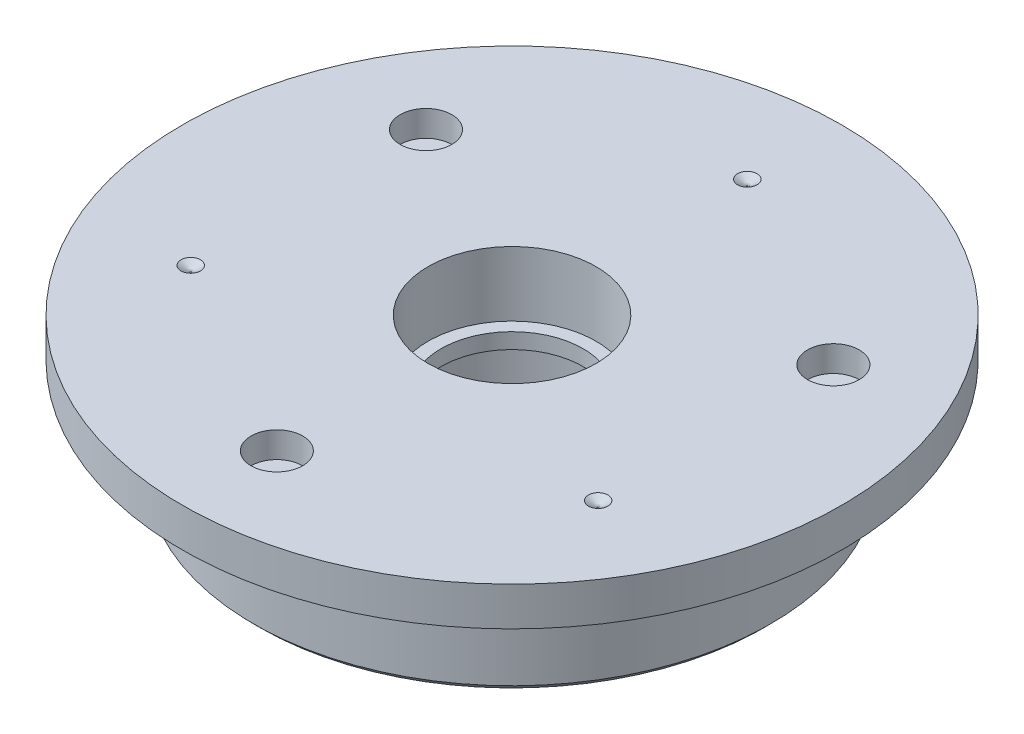
from build123d import *

# Parameters (mm, degrees)
SKETCH_1_W                  = 25.5
SKETCH_1_H                  = 3
SKETCH_2_R                  = 21.5
EXTRUDE_1_DEPTH             = 0.8
SKETCH_3_R                  = 20
EXTRUDE_2_DEPTH             = 7.4
HOLE_WIZARD_3_0_3_1_D       = 3
HOLE_WIZARD_3_0_3_1_DEPTH   = 3
HOLE_WIZARD_3_3_3_3_1_D     = 3.3
HOLE_WIZARD_3_3_3_3_1_DEPTH = 8
HOLE_WIZARD_3_3_3_3_1_TIP   = 0.991420021
HOLE_WIZARD_4_0_4_1_D       = 4
HOLE_WIZARD_4_0_4_1_DEPTH   = 2
CHAMFER_1_SIZE              = 0.375
CHAMFER_2_SIZE              = 0.5


with BuildPart() as part:
    # 草图1 → 旋转1 (revolve)
    with BuildSketch(Plane.XY, mode=Mode.PRIVATE) as revolve_1_sk:
        with Locations((12.75, -18.3)):
            Rectangle(SKETCH_1_W, SKETCH_1_H)
    revolve(revolve_1_sk.sketch.rotate(Axis((0, -16.8, 0), (0, -1, 0)), 270), axis=Axis((0, -16.8, 0), (0, -1, 0)))

    # 草图2 → 凸台-拉伸1 (add)
    with BuildSketch(Plane.XZ.offset(19.8)):
        with Locations(Location((0, 0, 0), (0, 0, 90))):
            Circle(SKETCH_2_R)
    extrude(amount=EXTRUDE_1_DEPTH)

    # 草图3 → 凸台-拉伸2 (add)
    with BuildSketch(Plane.XZ.offset(20.6)):
        with Locations(Location((0, 0, 0), (0, 0, 270))):
            Circle(SKETCH_3_R)
    extrude(amount=EXTRUDE_2_DEPTH)

    # 草图4 → 切除-旋转1 (revolve, cut)
    with BuildSketch(Plane.XY.offset(9.1), mode=Mode.PRIVATE) as cut_revolve_1_sk:
        Polygon((-15.010946194, -16.8), (-15.761662349, -16.8), (-15.761662349, -17.251075774), align=None)
    revolve(cut_revolve_1_sk.sketch.rotate(Axis((-15.761662349, -16.8, 9.1), (0, -1, 0)), 90), axis=Axis((-15.761662349, -16.8, 9.1), (0, -1, 0)), mode=Mode.SUBTRACT)

    # 草图5 → 切除-旋转2 (revolve, cut)
    with BuildSketch(Plane.XY.offset(9.1), mode=Mode.PRIVATE) as cut_revolve_2_sk:
        Polygon((16.512378504, -16.8), (15.761662349, -16.8), (15.761662349, -17.251075774), align=None)
    revolve(cut_revolve_2_sk.sketch.rotate(Axis((15.761662349, -16.8, 9.1), (0, -1, 0)), 90), axis=Axis((15.761662349, -16.8, 9.1), (0, -1, 0)), mode=Mode.SUBTRACT)

    # 草图6 → 切除-旋转3 (revolve, cut)
    with BuildSketch(Plane.XY.offset(-18.2), mode=Mode.PRIVATE) as cut_revolve_3_sk:
        Polygon((0.750716155, -16.8), (0, -16.8), (0, -17.251075774), align=None)
    revolve(cut_revolve_3_sk.sketch.rotate(Axis((0, -16.8, -18.2), (0, -1, 0)), 90), axis=Axis((0, -16.8, -18.2), (0, -1, 0)), mode=Mode.SUBTRACT)

    # 草图7 → 切除-旋转4 (revolve, cut)
    with BuildSketch(Plane(origin=(0, 0, 0), x_dir=(-1, 0, 0), z_dir=(0, 0, -1)), mode=Mode.PRIVATE) as cut_revolve_4_sk:
        Polygon((-9, -28), (0, -28), (0, -16.8), (-6.5, -16.8), (-6.5, -21.8), (-5.5, -21.8), (-5.5, -23), (-9, -23), align=None)
    revolve(cut_revolve_4_sk.sketch.rotate(Axis((0, -28, 0), (0, 1, 0)), 270), axis=Axis((0, -28, 0), (0, 1, 0)), mode=Mode.SUBTRACT)

    # Ø3.0 (3) 直径孔1
    with Locations(Plane(origin=(0, -28, 0), x_dir=(-1, 0, 0), z_dir=(0, -1, 0))):
        with Locations((6, 10.392304845), (-6, -10.392304845)):
            Hole(HOLE_WIZARD_3_0_3_1_D / 2, depth=HOLE_WIZARD_3_0_3_1_DEPTH)

    # Ø3.3 (3.3) 直径孔1
    with Locations(Plane(origin=(0, -28, 0), x_dir=(-1, 0, 0), z_dir=(0, -1, 0))):
        with Locations((10.392304845, -6), (0, -12), (-10.392304845, -6), (-10.392304845, 6), (0, 12), (10.392304845, 6)):
            Hole(HOLE_WIZARD_3_3_3_3_1_D / 2, depth=HOLE_WIZARD_3_3_3_3_1_DEPTH)
            with Locations((0, 0, -(HOLE_WIZARD_3_3_3_3_1_DEPTH + HOLE_WIZARD_3_3_3_3_1_TIP / 2))):  # 118° drill point
                Cone(0, HOLE_WIZARD_3_3_3_3_1_D / 2, HOLE_WIZARD_3_3_3_3_1_TIP, mode=Mode.SUBTRACT)

    # Ø4.0 (4) 直径孔1
    with Locations(Plane(origin=(0, -16.8, 0), x_dir=(1, 0, 0), z_dir=(0, 1, 0))):
        with Locations((15.761662349, 9.1), (0, -18.2), (-15.761662349, 9.1)):
            Hole(HOLE_WIZARD_4_0_4_1_D / 2, depth=HOLE_WIZARD_4_0_4_1_DEPTH)

    # 倒角1
    chamfer_1_edges = [part.edges().sort_by_distance(p)[0] for p in [
        (-12.042304845, -28, -6),
        (-1.65, -28, -12),
        (8.742304845, -28, -6),
        (8.742304845, -28, 6),
        (-1.65, -28, 12),
        (-12.042304845, -28, 6),
    ]]
    chamfer(chamfer_1_edges, length=CHAMFER_1_SIZE)

    # 倒角2
    chamfer_2_edges = [part.edges().sort_by_distance(p)[0] for p in [
        (0, -28, 20),
    ]]
    chamfer(chamfer_2_edges, length=CHAMFER_2_SIZE)


solid = part.part
